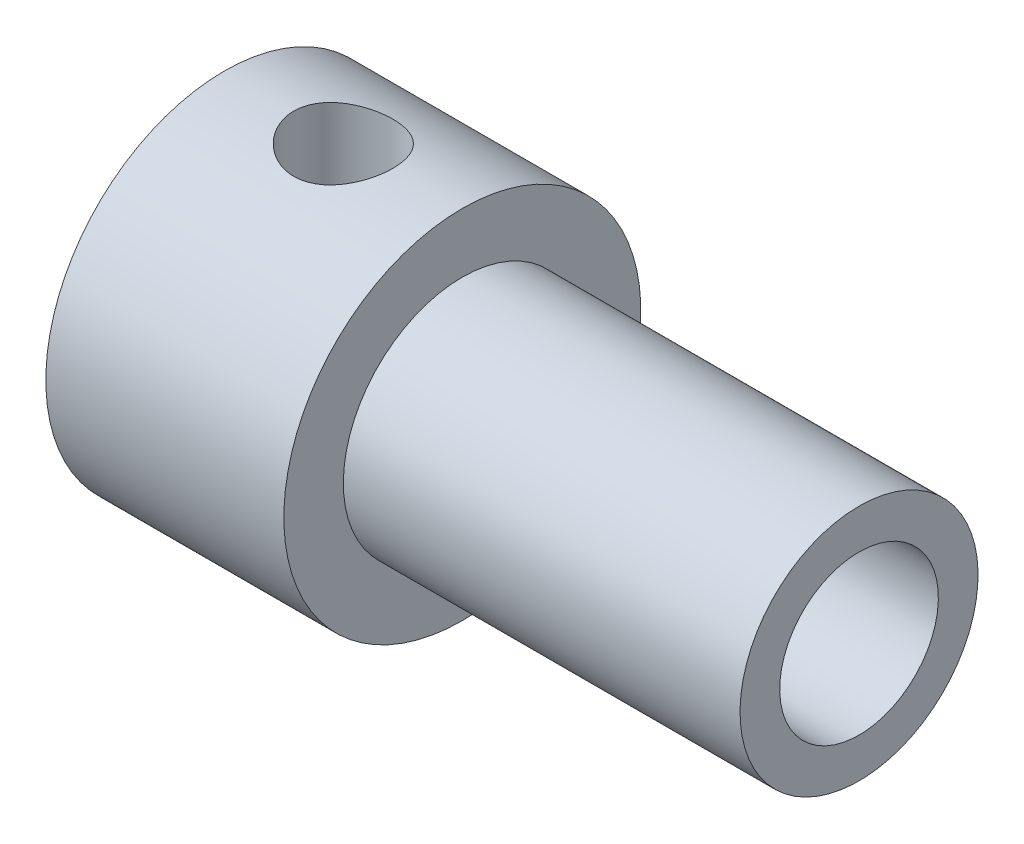
from build123d import *

# Parameters (mm, degrees)
ESQUISSE3_R             = 1.25
ENL_V_MAT_EXTRU_1_DEPTH = 6


with BuildPart() as part:
    # Esquisse1 → Révolution1 (revolve)
    with BuildSketch(Plane.XY):
        Polygon((0, 0), (0, 1), (-10, 1), (-10, 2.5), (-16, 2.5), (-16, 0), align=None)
    revolve(axis=Axis((0, -2, 0), (-1, 0, 0)))

    # Esquisse3 → Enlèv. mat.-Extru.1 (cut)
    with BuildSketch(Plane(origin=(0, 3, 0), x_dir=(-1, 0, 0), z_dir=(0, 1, 0))):
        with Locations((13, 0)):
            Circle(ESQUISSE3_R)
    extrude(amount=-ENL_V_MAT_EXTRU_1_DEPTH, mode=Mode.SUBTRACT)


solid = part.part
